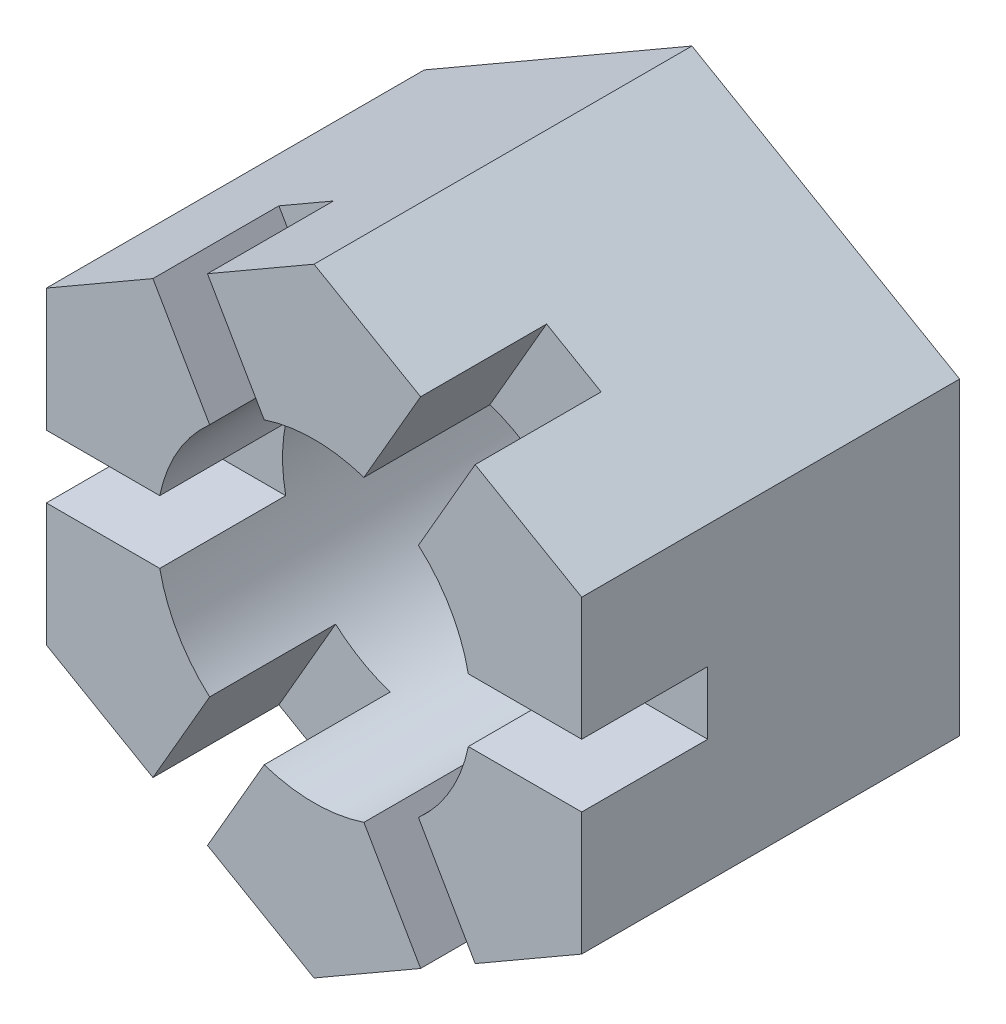
from build123d import *

# Parameters (mm, degrees)
ESBO_O2_R                  = 5
RESSALTO_EXTRUS_O2_DEPTH   = 12
CORTE_EXTRUS_O1_REACH      = 25.007
CORTE_EXTRUS_O1_END_RADIUS = 5
ESBO_O3_W                  = 4
ESBO_O3_H                  = 2
PADR_OCIRCULAR1_COUNT      = 6


with BuildPart() as part:
    # Esboço2 → Ressalto-extrusão2 (new body)
    with BuildSketch(Plane.XY):
        Polygon((0, 9.814954576), (8.5, 4.907477288), (8.5, -4.907477288), (0, -9.814954576), (-8.5, -4.907477288), (-8.5, 4.907477288), align=None)
        Circle(ESBO_O2_R, mode=Mode.SUBTRACT)
    extrude(amount=RESSALTO_EXTRUS_O2_DEPTH)

    # Corte-extrusão1: up to this cylinder (the profile starts outside it)
    corte_extrus_o1_end = Plane(origin=(0, 0, 10), z_dir=(0, 0, -1)) * Cylinder(CORTE_EXTRUS_O1_END_RADIUS, 61.014, mode=Mode.PRIVATE)
    # Esboço3 → Corte-extrusão1 (cut, up to the surface)
    with BuildSketch(Plane(origin=(8.5, 0, 0), x_dir=(0, 0, -1), z_dir=(1, 0, 0)), mode=Mode.PRIVATE) as corte_extrus_o1_sk1:
        with Locations((-10, 0)):
            Rectangle(ESBO_O3_W, ESBO_O3_H)
    corte_extrus_o1_tool1 = extrude(corte_extrus_o1_sk1.sketch, amount=-CORTE_EXTRUS_O1_REACH, mode=Mode.PRIVATE) - corte_extrus_o1_end
    corte_extrus_o1 = corte_extrus_o1_tool1.solids().sort_by_distance((8.5, 0, 10))[0]
    add(corte_extrus_o1, mode=Mode.SUBTRACT)

    # PadrãoCircular1: Corte-extrusão1 ×6 about axis
    padr_ocircular1_axis = Axis((0, 0, 0), (0, 0, 1))
    for i in range(1, PADR_OCIRCULAR1_COUNT):
        add(corte_extrus_o1.rotate(padr_ocircular1_axis, i * 360 / PADR_OCIRCULAR1_COUNT), mode=Mode.SUBTRACT)


solid = part.part
